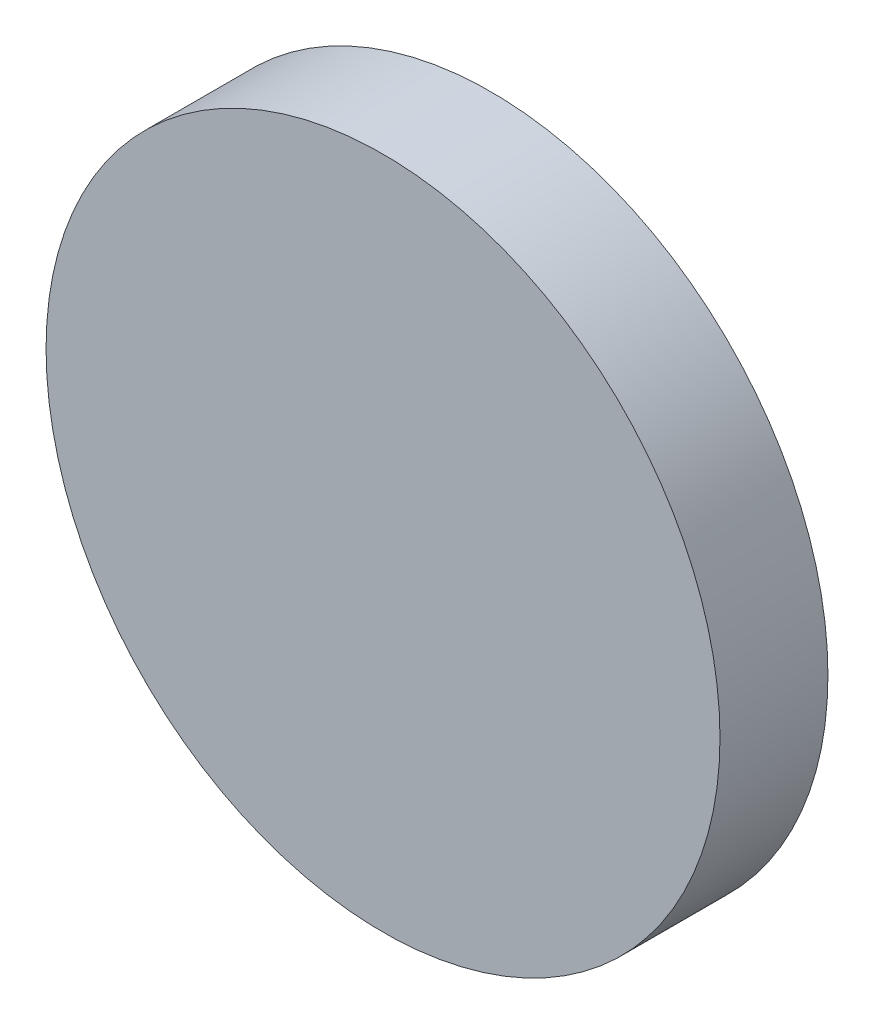
from build123d import *

# Parameters (mm, degrees)
SKETCH1_R           = 31.21504346
BOSS_EXTRUDE1_DEPTH = 10


with BuildPart() as part:
    # Sketch1 → Boss-Extrude1 (new body)
    with BuildSketch(Plane.XY):
        Circle(SKETCH1_R)
    extrude(amount=BOSS_EXTRUDE1_DEPTH)


solid = part.part
